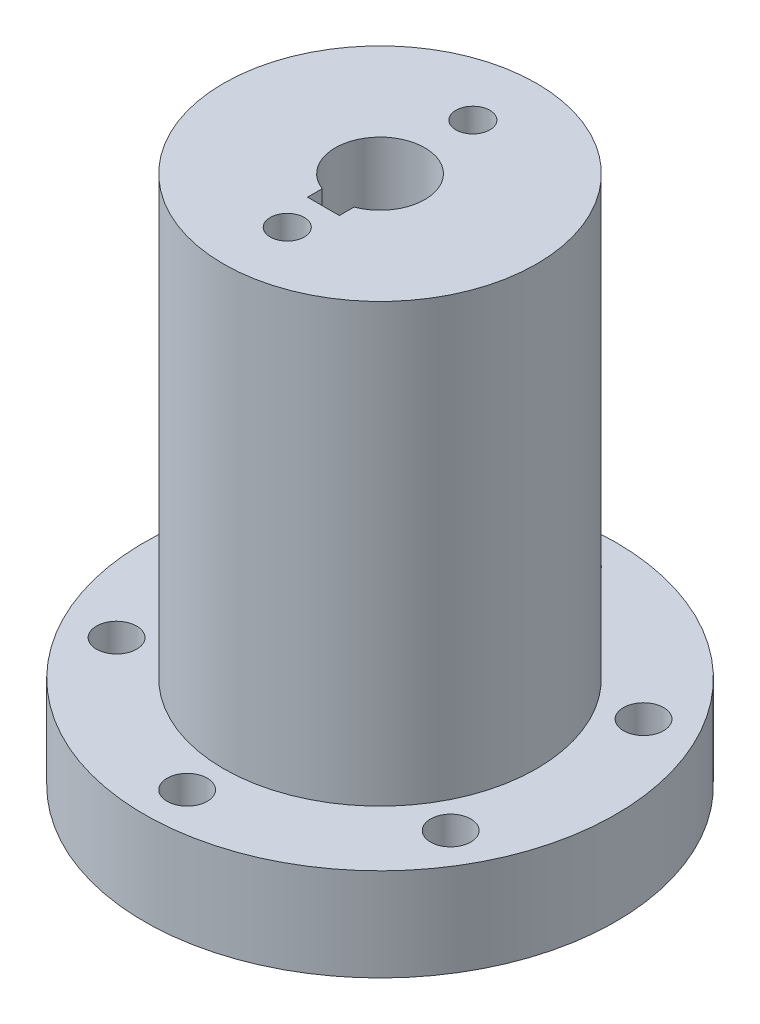
from build123d import *

# Parameters (mm, degrees)
SKETCH1_R           = 25.3
BOSS_EXTRUDE1_DEPTH = 8.5
SKETCH2_R           = 25.3
BOSS_EXTRUDE2_DEPTH = 57.15
SKETCH7_R           = 25.3
BOSS_EXTRUDE4_DEPTH = 15
CUT_EXTRUDE3_DEPTH  = 115
SKETCH6_R           = 38.1
BOSS_EXTRUDE3_DEPTH = 15
SKETCH9_R           = 3.25
CUT_EXTRUDE4_DEPTH  = 20
SKETCH10_R          = 2.75
CUT_EXTRUDE6_DEPTH  = 129
BOSS_EXTRUDE5_START = -93
BOSS_EXTRUDE5_DEPTH = 93
CUT_EXTRUDE7_DEPTH  = 40
CUT_EXTRUDE8_START  = -10
SKETCH12_R          = 25.3
CUT_EXTRUDE8_DEPTH  = 10


with BuildPart() as part:
    # Sketch1 → Boss-Extrude1 (new body)
    with BuildSketch(Plane(origin=(0, 0, 0), x_dir=(1, 0, 0), z_dir=(0, 1, 0))):
        Circle(SKETCH1_R)
    extrude(amount=BOSS_EXTRUDE1_DEPTH)

    # Sketch2 → Boss-Extrude2 (add)
    with BuildSketch(Plane(origin=(0, 8.5, 0), x_dir=(1, 0, 0), z_dir=(0, 1, 0))):
        Circle(SKETCH2_R)
    extrude(amount=BOSS_EXTRUDE2_DEPTH)

    # Sketch7 → Boss-Extrude4 (add)
    with BuildSketch(Plane(origin=(0, 65.65, 0), x_dir=(1, 0, 0), z_dir=(0, 1, 0))):
        Circle(SKETCH7_R)
    extrude(amount=BOSS_EXTRUDE4_DEPTH)

    # Sketch5 → Cut-Extrude3 (cut)
    with BuildSketch(Plane.XZ):
        with BuildLine():
            Line((2.575, 9.15), (-2.575, 9.15))
            Line((-2.575, 9.15), (-2.575, 6.777305881))
            ThreePointArc((-2.575, 6.777305881), (0, -7.25), (2.575, 6.777305881))
            Line((2.575, 6.777305881), (2.575, 9.15))
        make_face()
    extrude(amount=-CUT_EXTRUDE3_DEPTH, mode=Mode.SUBTRACT)

    # Sketch6 → Boss-Extrude3 (add)
    with BuildSketch(Plane.XZ):
        Circle(SKETCH6_R)
    extrude(amount=BOSS_EXTRUDE3_DEPTH)

    # Sketch9 → Cut-Extrude4 (cut)
    with BuildSketch(Plane(origin=(0, 0, 0), x_dir=(1, 0, 0), z_dir=(0, 1, 0))):
        with Locations((0, 31.176914536)):
            Circle(SKETCH9_R)
        with Locations((-27, 15.588457268)):
            Circle(SKETCH9_R)
        with Locations((27, 15.588457268)):
            Circle(SKETCH9_R)
        with Locations((-27, -15.588457268)):
            Circle(SKETCH9_R)
        with Locations((27, -15.588457268)):
            Circle(SKETCH9_R)
        with Locations((0, -31.176914536)):
            Circle(SKETCH9_R)
    extrude(amount=-CUT_EXTRUDE4_DEPTH, mode=Mode.SUBTRACT)

    # Sketch10 → Cut-Extrude6 (cut)
    with BuildSketch(Plane(origin=(0, 80.65, 0), x_dir=(1, 0, 0), z_dir=(0, 1, 0))):
        with Locations((0, 15)):
            Circle(SKETCH10_R)
        with Locations((0, -15)):
            Circle(SKETCH10_R)
    extrude(amount=-CUT_EXTRUDE6_DEPTH, mode=Mode.SUBTRACT)

    # Sketch11 → Boss-Extrude5 (add)
    with BuildSketch(Plane(origin=(0, 80.65, 0), x_dir=(1, 0, 0), z_dir=(0, 1, 0)).offset(BOSS_EXTRUDE5_START)):
        with BuildLine():
            Line((2.575, -9.15), (2.575, -6.777305881))
            ThreePointArc((2.575, -6.777305881), (0, 7.25), (-2.575, -6.777305881))
            Line((-2.575, -6.777305881), (-2.575, -9.15))
            Line((-2.575, -9.15), (2.575, -9.15))
        make_face()
    extrude(amount=BOSS_EXTRUDE5_DEPTH)

    # Sketch11<3> → Cut-Extrude7 (cut)
    with BuildSketch(Plane(origin=(0, 80.65, 0), x_dir=(1, 0, 0), z_dir=(0, 1, 0))):
        with BuildLine():
            Line((2.575, -9.15), (2.575, -6.777305881))
            ThreePointArc((2.575, -6.777305881), (0, 7.25), (-2.575, -6.777305881))
            Line((-2.575, -6.777305881), (-2.575, -9.15))
            Line((-2.575, -9.15), (2.575, -9.15))
        make_face()
    extrude(amount=-CUT_EXTRUDE7_DEPTH, mode=Mode.SUBTRACT)

    # Sketch12 → Cut-Extrude8 (cut)
    with BuildSketch(Plane(origin=(0, 80.65, 0), x_dir=(1, 0, 0), z_dir=(0, 1, 0)).offset(CUT_EXTRUDE8_START)):
        Circle(SKETCH12_R)
    extrude(amount=CUT_EXTRUDE8_DEPTH, mode=Mode.SUBTRACT)


solid = part.part
